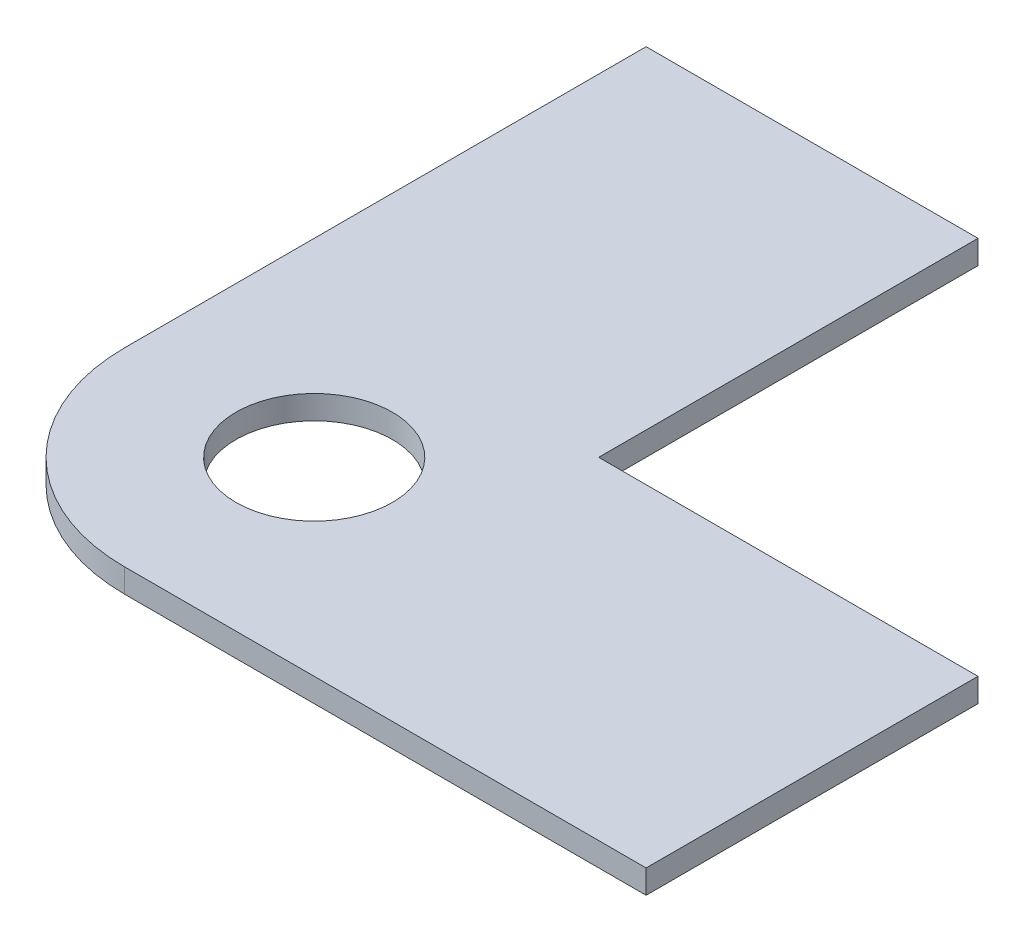
from build123d import *

# Parameters (mm, degrees)
SKETCH1_R           = 1.65
BOSS_EXTRUDE1_DEPTH = 0.5


with BuildPart() as part:
    # Sketch1 → Boss-Extrude1 (new body)
    with BuildSketch(Plane(origin=(0, 0, 0), x_dir=(1, 0, 0), z_dir=(0, 1, 0))):
        with BuildLine():
            Line((11, -3.99967418), (11, 3))
            Line((11, 3), (3, 3))
            Line((3, 3), (3, 11))
            Line((3, 11), (-3.99967418, 11))
            Line((-3.99967418, 11), (-3.99967418, 0))
            ThreePointArc((-3.99967418, 0), (-2.828196736, -2.828196736), (0, -3.99967418))
            Line((0, -3.99967418), (11, -3.99967418))
        make_face()
        with Locations(Location((0, 0, 0), (0, 0, 270))):
            Circle(SKETCH1_R, mode=Mode.SUBTRACT)
    extrude(amount=BOSS_EXTRUDE1_DEPTH)


solid = part.part
